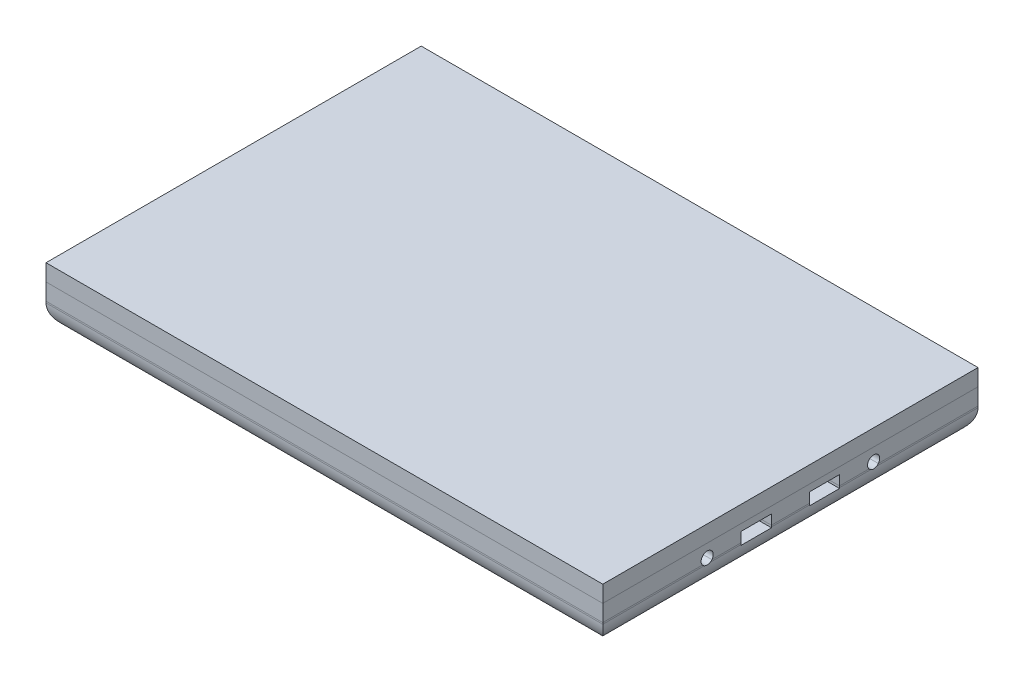
from build123d import *

# Parameters (mm, degrees)
SKETCH1_W           = 184
SKETCH1_H           = 124
BOSS_EXTRUDE1_DEPTH = 5.5
SKETCH1_2_W         = 184
SKETCH1_2_H         = 124
BOSS_EXTRUDE2_DEPTH = 5.5
SKETCH2_W           = 184
SKETCH2_H           = 124
BOSS_EXTRUDE3_DEPTH = 8.5
FILLET1_R           = 8
SKETCH3_W           = 10
SKETCH3_H           = 4
SKETCH3_R           = 2
CUT_EXTRUDE1_DEPTH  = 8.5


with BuildPart() as part:
    # Sketch1 → Boss-Extrude1 (new body)
    with BuildSketch(Plane(origin=(0, 0, 0), x_dir=(1, 0, 0), z_dir=(0, 1, 0))):
        Rectangle(SKETCH1_W, SKETCH1_H)
    extrude(amount=BOSS_EXTRUDE1_DEPTH)


with BuildPart() as body_2:
    # Sketch1<2> → Boss-Extrude2 (new body)
    with BuildSketch(Plane(origin=(0, 0, 0), x_dir=(1, 0, 0), z_dir=(0, 1, 0))):
        Rectangle(SKETCH1_2_W, SKETCH1_2_H)
    extrude(amount=-BOSS_EXTRUDE2_DEPTH)


with BuildPart() as body_3:
    # Sketch2 → Boss-Extrude3 (new body)
    with BuildSketch(Plane(origin=(0, -5.5, 0), x_dir=(-1, 0, 0), z_dir=(0, -1, 0))):
        Rectangle(SKETCH2_W, SKETCH2_H)
    extrude(amount=BOSS_EXTRUDE3_DEPTH)

    # Fillet1
    fillet1_edges = [body_3.edges().sort_by_distance(p)[0] for p in [
        (92, -14, 0),
        (0, -14, 62),
        (-92, -14, 0),
        (0, -14, -62),
    ]]
    fillet(fillet1_edges, radius=FILLET1_R)


with BuildPart() as cut_extrude1_tool:
    # Sketch3 → Cut-Extrude1 (new body)
    with BuildSketch(Plane(origin=(92, 0, 0), x_dir=(0, 0, -1), z_dir=(1, 0, 0))):
        with Locations((-11.25, -4.25)):
            Rectangle(SKETCH3_W, SKETCH3_H)
        with Locations((-27.5, -4.25)):
            Circle(SKETCH3_R)
    cut_extrude1 = extrude(amount=-CUT_EXTRUDE1_DEPTH)


with BuildPart() as body_2_1:
    add(body_2.part)

    # Cut-Extrude1: cut by cut_extrude1_tool
    add(cut_extrude1_tool.part, mode=Mode.SUBTRACT)


with BuildPart() as body_3_1:
    add(body_3.part)

    # Cut-Extrude1: cut by cut_extrude1_tool
    add(cut_extrude1_tool.part, mode=Mode.SUBTRACT)


with BuildPart() as mirror1_tool:
    # Mirror1: Cut-Extrude1 across plane
    add(cut_extrude1.mirror(Plane.XY))


with BuildPart() as body_2_2:
    add(body_2_1.part)

    # Mirror1: cut by mirror1_tool
    add(mirror1_tool.part, mode=Mode.SUBTRACT)


with BuildPart() as body_3_2:
    add(body_3_1.part)

    # Mirror1: cut by mirror1_tool
    add(mirror1_tool.part, mode=Mode.SUBTRACT)


solid = Compound([part.part, body_2_2.part, body_3_2.part])
